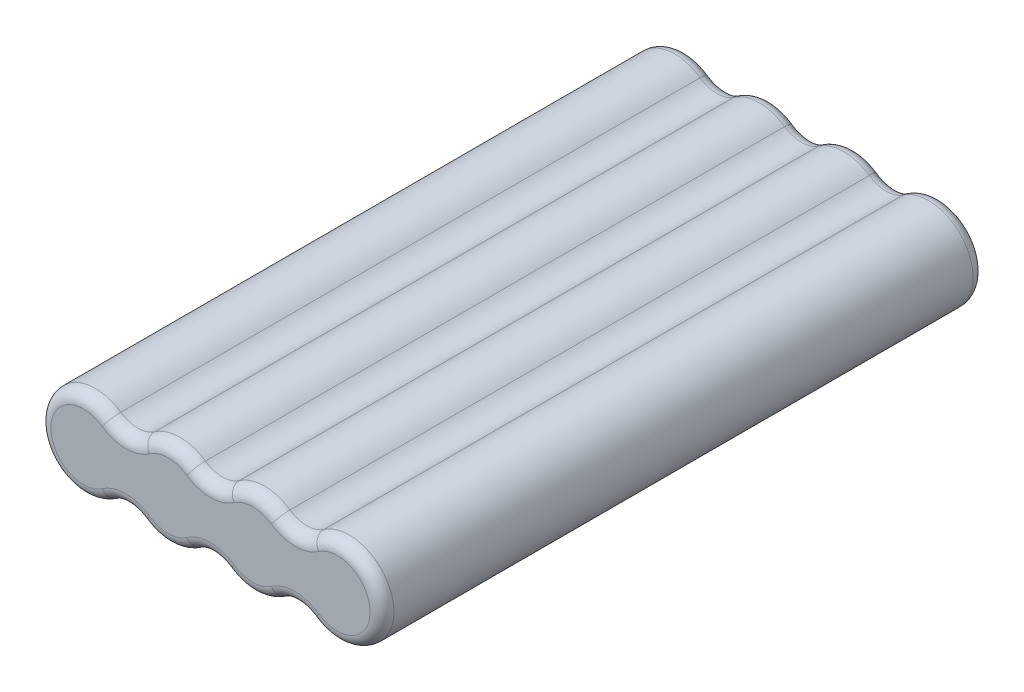
from build123d import *

# Parameters (mm, degrees)
BOSS_EXTRUDE1_DEPTH = 50.673
FILLET1_R           = 2


with BuildPart() as part:
    # Sketch1 → Boss-Extrude1 (new, symmetric)
    with BuildSketch(Plane.XY):
        with BuildLine():
            ThreePointArc((-17.0632, 6.168707349), (-28.829, 0), (-17.0632, -6.168707349))
            ThreePointArc((-17.0632, -6.168707349), (-14.219333333, -5.281178915), (-11.375466667, -6.168707349))
            ThreePointArc((-11.375466667, -6.168707349), (-7.109666667, -7.5), (-2.843866667, -6.168707349))
            ThreePointArc((-2.843866667, -6.168707349), (0, -5.281178915), (2.843866667, -6.168707349))
            ThreePointArc((2.843866667, -6.168707349), (7.109666667, -7.5), (11.375466667, -6.168707349))
            ThreePointArc((11.375466667, -6.168707349), (14.219333333, -5.281178915), (17.0632, -6.168707349))
            ThreePointArc((17.0632, -6.168707349), (28.829, 0), (17.0632, 6.168707349))
            ThreePointArc((17.0632, 6.168707349), (14.219333333, 5.281178915), (11.375466667, 6.168707349))
            ThreePointArc((11.375466667, 6.168707349), (7.109666667, 7.5), (2.843866667, 6.168707349))
            ThreePointArc((2.843866667, 6.168707349), (0, 5.281178915), (-2.843866667, 6.168707349))
            ThreePointArc((-2.843866667, 6.168707349), (-7.109666667, 7.5), (-11.375466667, 6.168707349))
            ThreePointArc((-11.375466667, 6.168707349), (-14.219333333, 5.281178915), (-17.0632, 6.168707349))
        make_face()
    extrude(amount=BOSS_EXTRUDE1_DEPTH, both=True)

    # Fillet1
    fillet1_edges = [part.edges().sort_by_distance(p)[0] for p in [
        (7.109666667, -7.5, -50.673),
        (0, -5.281178915, -50.673),
        (14.219333333, 5.281178915, 50.673),
        (-7.109666667, -7.5, -50.673),
        (-14.219333333, -5.281178915, -50.673),
        (-28.829, 0, -50.673),
        (-14.219333333, 5.281178915, -50.673),
        (-7.109666667, 7.5, -50.673),
        (0, 5.281178915, -50.673),
        (7.109666667, 7.5, -50.673),
        (14.219333333, 5.281178915, -50.673),
        (28.829, 0, -50.673),
        (14.219333333, -5.281178915, -50.673),
        (7.109666667, 7.5, 50.673),
        (0, 5.281178915, 50.673),
        (-7.109666667, 7.5, 50.673),
        (-14.219333333, 5.281178915, 50.673),
        (-28.829, 0, 50.673),
        (-14.219333333, -5.281178915, 50.673),
        (-7.109666667, -7.5, 50.673),
        (0, -5.281178915, 50.673),
        (7.109666667, -7.5, 50.673),
        (14.219333333, -5.281178915, 50.673),
        (28.829, 0, 50.673),
    ]]
    fillet(fillet1_edges, radius=FILLET1_R)


solid = part.part
